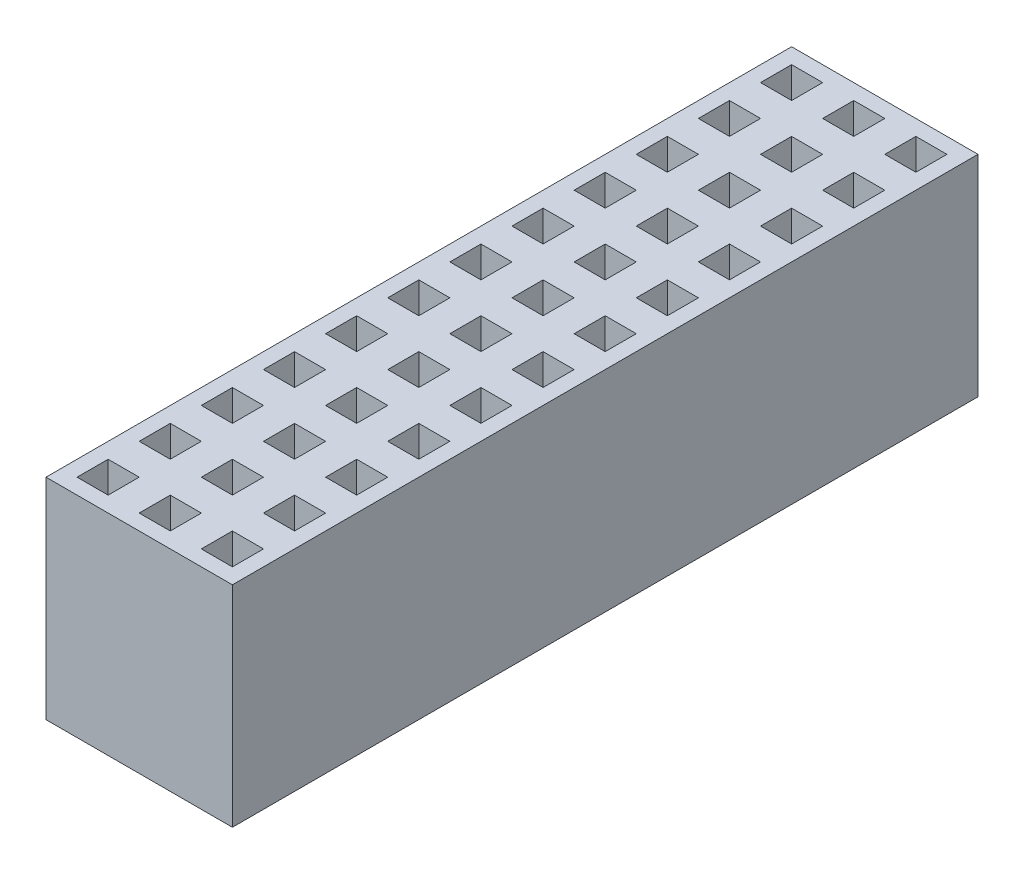
from build123d import *

# Parameters (mm, degrees)
SKETCH1_W           = 7.62
SKETCH1_H           = 30.48
SKETCH1_W_2         = 1.27
SKETCH1_H_2         = 1.27
BOSS_EXTRUDE1_DEPTH = 8.5852


with BuildPart() as part:
    # Sketch1 → Boss-Extrude1 (new body)
    with BuildSketch(Plane(origin=(0, 0, 0), x_dir=(1, 0, 0), z_dir=(0, 1, 0))):
        Rectangle(SKETCH1_W, SKETCH1_H)
        with Locations((-2.54, 13.97)):
            Rectangle(SKETCH1_W_2, SKETCH1_H_2, mode=Mode.SUBTRACT)
        with Locations((0, 13.97)):
            Rectangle(SKETCH1_W_2, SKETCH1_H_2, mode=Mode.SUBTRACT)
        with Locations((2.54, 13.97)):
            Rectangle(SKETCH1_W_2, SKETCH1_H_2, mode=Mode.SUBTRACT)
        with Locations((-2.54, 11.43)):
            Rectangle(SKETCH1_W_2, SKETCH1_H_2, mode=Mode.SUBTRACT)
        with Locations((0, 11.43)):
            Rectangle(SKETCH1_W_2, SKETCH1_H_2, mode=Mode.SUBTRACT)
        with Locations((2.54, 11.43)):
            Rectangle(SKETCH1_W_2, SKETCH1_H_2, mode=Mode.SUBTRACT)
        with Locations((-2.54, 8.89)):
            Rectangle(SKETCH1_W_2, SKETCH1_H_2, mode=Mode.SUBTRACT)
        with Locations((0, 8.89)):
            Rectangle(SKETCH1_W_2, SKETCH1_H_2, mode=Mode.SUBTRACT)
        with Locations((2.54, 8.89)):
            Rectangle(SKETCH1_W_2, SKETCH1_H_2, mode=Mode.SUBTRACT)
        with Locations((-2.54, 6.35)):
            Rectangle(SKETCH1_W_2, SKETCH1_H_2, mode=Mode.SUBTRACT)
        with Locations((0, 6.35)):
            Rectangle(SKETCH1_W_2, SKETCH1_H_2, mode=Mode.SUBTRACT)
        with Locations((2.54, 6.35)):
            Rectangle(SKETCH1_W_2, SKETCH1_H_2, mode=Mode.SUBTRACT)
        with Locations((-2.54, 3.81)):
            Rectangle(SKETCH1_W_2, SKETCH1_H_2, mode=Mode.SUBTRACT)
        with Locations((0, 3.81)):
            Rectangle(SKETCH1_W_2, SKETCH1_H_2, mode=Mode.SUBTRACT)
        with Locations((2.54, 3.81)):
            Rectangle(SKETCH1_W_2, SKETCH1_H_2, mode=Mode.SUBTRACT)
        with Locations((-2.54, 1.27)):
            Rectangle(SKETCH1_W_2, SKETCH1_H_2, mode=Mode.SUBTRACT)
        with Locations((0, 1.27)):
            Rectangle(SKETCH1_W_2, SKETCH1_H_2, mode=Mode.SUBTRACT)
        with Locations((2.54, 1.27)):
            Rectangle(SKETCH1_W_2, SKETCH1_H_2, mode=Mode.SUBTRACT)
        with Locations((-2.54, -1.27)):
            Rectangle(SKETCH1_W_2, SKETCH1_H_2, mode=Mode.SUBTRACT)
        with Locations((0, -1.27)):
            Rectangle(SKETCH1_W_2, SKETCH1_H_2, mode=Mode.SUBTRACT)
        with Locations((2.54, -1.27)):
            Rectangle(SKETCH1_W_2, SKETCH1_H_2, mode=Mode.SUBTRACT)
        with Locations((-2.54, -3.81)):
            Rectangle(SKETCH1_W_2, SKETCH1_H_2, mode=Mode.SUBTRACT)
        with Locations((0, -3.81)):
            Rectangle(SKETCH1_W_2, SKETCH1_H_2, mode=Mode.SUBTRACT)
        with Locations((2.54, -3.81)):
            Rectangle(SKETCH1_W_2, SKETCH1_H_2, mode=Mode.SUBTRACT)
        with Locations((-2.54, -6.35)):
            Rectangle(SKETCH1_W_2, SKETCH1_H_2, mode=Mode.SUBTRACT)
        with Locations((0, -6.35)):
            Rectangle(SKETCH1_W_2, SKETCH1_H_2, mode=Mode.SUBTRACT)
        with Locations((2.54, -6.35)):
            Rectangle(SKETCH1_W_2, SKETCH1_H_2, mode=Mode.SUBTRACT)
        with Locations((-2.54, -8.89)):
            Rectangle(SKETCH1_W_2, SKETCH1_H_2, mode=Mode.SUBTRACT)
        with Locations((0, -8.89)):
            Rectangle(SKETCH1_W_2, SKETCH1_H_2, mode=Mode.SUBTRACT)
        with Locations((2.54, -8.89)):
            Rectangle(SKETCH1_W_2, SKETCH1_H_2, mode=Mode.SUBTRACT)
        with Locations((-2.54, -11.43)):
            Rectangle(SKETCH1_W_2, SKETCH1_H_2, mode=Mode.SUBTRACT)
        with Locations((0, -11.43)):
            Rectangle(SKETCH1_W_2, SKETCH1_H_2, mode=Mode.SUBTRACT)
        with Locations((2.54, -11.43)):
            Rectangle(SKETCH1_W_2, SKETCH1_H_2, mode=Mode.SUBTRACT)
        with Locations((-2.54, -13.97)):
            Rectangle(SKETCH1_W_2, SKETCH1_H_2, mode=Mode.SUBTRACT)
        with Locations((0, -13.97)):
            Rectangle(SKETCH1_W_2, SKETCH1_H_2, mode=Mode.SUBTRACT)
        with Locations((2.54, -13.97)):
            Rectangle(SKETCH1_W_2, SKETCH1_H_2, mode=Mode.SUBTRACT)
    extrude(amount=BOSS_EXTRUDE1_DEPTH)


solid = part.part
